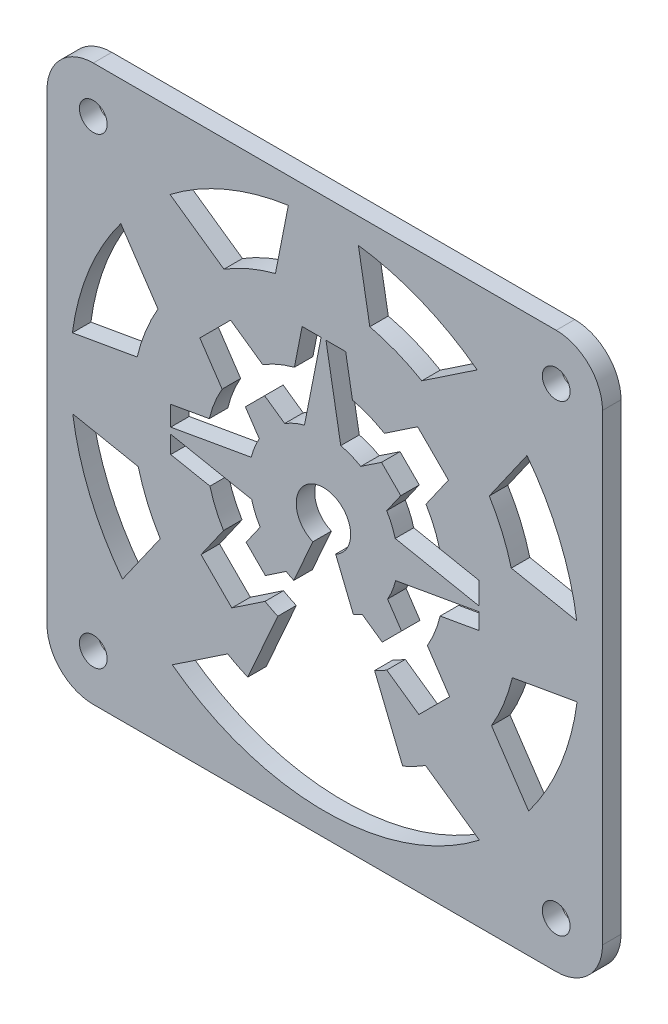
from build123d import *

# Parameters (mm, degrees)
SCHIZZO1_R                   = 1.5
ESTRUSIONE_ESTRUSIONE1_DEPTH = 2
TAGLIO_ESTRUSIONE1_DEPTH     = 2
ESTRUSIONE_ESTRUSIONE2_DEPTH = 2


with BuildPart() as part:
    # Schizzo1 → Estrusione-Estrusione1 (new body)
    with BuildSketch(Plane.XY):
        with BuildLine():
            Line((4.009057919, 37.078949925), (4.009057919, -12.921050075))
            ThreePointArc((4.009057919, -12.921050075), (2.544591824, -16.456583981), (-0.990942081, -17.921050075))
            Line((-0.990942081, -17.921050075), (-50.990942081, -17.921050075))
            ThreePointArc((-50.990942081, -17.921050075), (-54.526475987, -16.456583981), (-55.990942081, -12.921050075))
            Line((-55.990942081, -12.921050075), (-55.990942081, 37.078949925))
            ThreePointArc((-55.990942081, 37.078949925), (-54.526475987, 40.614483831), (-50.990942081, 42.078949925))
            Line((-50.990942081, 42.078949925), (-0.990942081, 42.078949925))
            ThreePointArc((-0.990942081, 42.078949925), (2.544591824, 40.614483831), (4.009057919, 37.078949925))
        make_face()
        with Locations((-50.990942081, 37.078949925)):
            Circle(SCHIZZO1_R, mode=Mode.SUBTRACT)
        with Locations((-0.990942081, 37.078949925)):
            Circle(SCHIZZO1_R, mode=Mode.SUBTRACT)
        with Locations((-50.990942081, -12.921050075)):
            Circle(SCHIZZO1_R, mode=Mode.SUBTRACT)
        with Locations((-0.990942081, -12.921050075)):
            Circle(SCHIZZO1_R, mode=Mode.SUBTRACT)
        with BuildLine():
            Line((-31.315733716, 32.226325066), (-29.922818488, 39.296413949))
            ThreePointArc((-29.922818488, 39.296413949), (-36.65420027, 37.427419796), (-42.697428035, 33.922560594))
            Line((-42.697428035, 33.922560594), (-36.878383255, 29.847848476))
            ThreePointArc((-36.878383255, 29.847848476), (-34.183829904, 31.240022968), (-31.315733716, 32.226325066))
        make_face(mode=Mode.SUBTRACT)
        with BuildLine():
            Line((-22.358446359, 39.337984663), (-21.125016906, 32.342042069))
            ThreePointArc((-21.125016906, 32.342042069), (-18.235263935, 31.421121146), (-15.509792769, 30.090491783))
            Line((-15.509792769, 30.090491783), (-9.525545173, 34.104859773))
            ThreePointArc((-9.525545173, 34.104859773), (-15.606929318, 37.543087038), (-22.358446359, 39.337984663))
        make_face(mode=Mode.SUBTRACT)
        with BuildLine():
            Line((-4.147331412, 28.785435879), (-8.22204353, 22.966391099))
            ThreePointArc((-8.22204353, 22.966391099), (-6.829869038, 20.271837748), (-5.84356694, 17.403741559))
            Line((-5.84356694, 17.403741559), (1.226521943, 16.010826332))
            ThreePointArc((1.226521943, 16.010826332), (-0.642472211, 22.742208114), (-4.147331412, 28.785435879))
        make_face(mode=Mode.SUBTRACT)
        with BuildLine():
            Line((1.268092656, 8.446454203), (-5.727849938, 7.213024749))
            ThreePointArc((-5.727849938, 7.213024749), (-6.648770861, 4.323271778), (-7.979400223, 1.597800612))
            Line((-7.979400223, 1.597800612), (-3.965032233, -4.386446983))
            ThreePointArc((-3.965032233, -4.386446983), (-0.526804968, 1.694937161), (1.268092656, 8.446454203))
        make_face(mode=Mode.SUBTRACT)
        with BuildLine():
            Line((-9.284456128, -9.764660744), (-15.103500908, -5.689948626))
            ThreePointArc((-15.103500908, -5.689948626), (-16.317583854, -6.379009649), (-17.575076336, -6.985239929))
            Line((-17.575076336, -6.985239929), (-22.566296054, 5.239602614))
            ThreePointArc((-22.566296054, 5.239602614), (-26.23827157, 19.723797875), (-28.966350145, 5.032545245))
            Line((-28.966350145, 5.032545245), (-34.305917557, -7.029459582))
            ThreePointArc((-34.305917557, -7.029459582), (-35.404993092, -6.512601237), (-36.472091394, -5.932591934))
            Line((-36.472091394, -5.932591934), (-42.45633899, -9.946959923))
            ThreePointArc((-42.45633899, -9.946959923), (-25.839815546, -15.420634813), (-9.284456128, -9.764660744))
        make_face(mode=Mode.SUBTRACT)
        with BuildLine():
            Line((-47.834552751, -4.627536029), (-43.759840633, 1.191508751))
            ThreePointArc((-43.759840633, 1.191508751), (-45.152015125, 3.886062102), (-46.138317223, 6.754158291))
            Line((-46.138317223, 6.754158291), (-53.208406106, 8.147073518))
            ThreePointArc((-53.208406106, 8.147073518), (-51.339411952, 1.415691736), (-47.834552751, -4.627536029))
        make_face(mode=Mode.SUBTRACT)
        with BuildLine():
            Line((-53.249976819, 15.711445647), (-46.254034225, 16.944875101))
            ThreePointArc((-46.254034225, 16.944875101), (-45.333113302, 19.834628071), (-44.00248394, 22.560099238))
            Line((-44.00248394, 22.560099238), (-48.01685193, 28.544346833))
            ThreePointArc((-48.01685193, 28.544346833), (-51.455079195, 22.462962688), (-53.249976819, 15.711445647))
        make_face(mode=Mode.SUBTRACT)
    extrude(amount=ESTRUSIONE_ESTRUSIONE1_DEPTH)

    # Schizzo2 → Taglio-Estrusione1 (cut)
    with BuildSketch(Plane.XY):
        with BuildLine():
            Line((-29.267736933, 24.477334627), (-28.432897549, 28.714770282))
            Line((-28.432897549, 28.714770282), (-23.731058754, 28.714770282))
            Line((-23.731058754, 28.714770282), (-22.996526589, 24.54854509))
            ThreePointArc((-22.996526589, 24.54854509), (-21.218217068, 23.981824522), (-19.541004043, 23.162975684))
            Line((-19.541004043, 23.162975684), (-15.954363967, 25.56897458))
            Line((-15.954363967, 25.56897458), (-12.629661871, 22.244272484))
            Line((-12.629661871, 22.244272484), (-15.056235281, 18.778913724))
            ThreePointArc((-15.056235281, 18.778913724), (-14.199512517, 17.120727047), (-13.592557379, 15.355744777))
            Line((-13.592557379, 15.355744777), (-9.355121725, 14.520905393))
            Line((-9.355121725, 14.520905393), (-9.355121725, 9.819066597))
            Line((-9.355121725, 9.819066597), (-13.521346916, 9.084534432))
            ThreePointArc((-13.521346916, 9.084534432), (-14.088067484, 7.306224912), (-14.906916322, 5.629011886))
            Line((-14.906916322, 5.629011886), (-12.500917426, 2.042371811))
            Line((-12.500917426, 2.042371811), (-15.825619522, -1.282330286))
            Line((-15.825619522, -1.282330286), (-19.290978282, 1.144243124))
            ThreePointArc((-19.290978282, 1.144243124), (-20.038106249, 0.720205572), (-20.811947777, 0.347140784))
            Line((-20.811947777, 0.347140784), (-23.883467603, 7.870120811))
            ThreePointArc((-23.883467603, 7.870120811), (-26.524135322, 16.755636376), (-27.096941459, 7.503749758))
            Line((-27.096941459, 7.503749758), (-30.402118498, 0.037403083))
            ThreePointArc((-30.402118498, 0.037403083), (-31.442562341, 0.471316046), (-32.44088012, 0.994924166))
            Line((-32.44088012, 0.994924166), (-36.027520196, -1.411074731))
            Line((-36.027520196, -1.411074731), (-39.352222292, 1.913627366))
            Line((-39.352222292, 1.913627366), (-36.925648882, 5.378986126))
            ThreePointArc((-36.925648882, 5.378986126), (-37.782371646, 7.037172803), (-38.389326784, 8.802155073))
            Line((-38.389326784, 8.802155073), (-42.626762438, 9.636994457))
            Line((-42.626762438, 9.636994457), (-42.626762438, 14.338833252))
            Line((-42.626762438, 14.338833252), (-38.460537247, 15.073365418))
            ThreePointArc((-38.460537247, 15.073365418), (-37.893816679, 16.851674938), (-37.074967841, 18.528887964))
            Line((-37.074967841, 18.528887964), (-39.480966737, 22.115528039))
            Line((-39.480966737, 22.115528039), (-36.156264641, 25.440230135))
            Line((-36.156264641, 25.440230135), (-32.690905881, 23.013656726))
            ThreePointArc((-32.690905881, 23.013656726), (-31.032719203, 23.87037949), (-29.267736933, 24.477334627))
        make_face()
    extrude(amount=TAGLIO_ESTRUSIONE1_DEPTH, mode=Mode.SUBTRACT)

    # Schizzo3 → Estrusione-Estrusione2 (add)
    with BuildSketch(Plane.XY):
        with BuildLine():
            Line((-28.179815713, 19.609421722), (-26.38592332, 28.714770282))
            Line((-26.38592332, 28.714770282), (-25.857793685, 28.714770282))
            Line((-25.857793685, 28.714770282), (-24.260309247, 19.653928262))
            ThreePointArc((-24.260309247, 19.653928262), (-23.148865797, 19.299727906), (-22.100607656, 18.787947383))
            Line((-22.100607656, 18.787947383), (-19.858957609, 20.291696693))
            Line((-19.858957609, 20.291696693), (-17.781018799, 18.213757883))
            Line((-17.781018799, 18.213757883), (-19.29762718, 16.047908658))
            ThreePointArc((-19.29762718, 16.047908658), (-18.762175452, 15.011541984), (-18.382828491, 13.908428066))
            Line((-18.382828491, 13.908428066), (-9.355121725, 12.129832289))
            Line((-9.355121725, 12.129832289), (-9.355121725, 11.572717293))
            Line((-9.355121725, 11.572717293), (-18.338321952, 9.9889216))
            ThreePointArc((-18.338321952, 9.9889216), (-18.692522307, 8.87747815), (-19.204302831, 7.829220009))
            Line((-19.204302831, 7.829220009), (-17.70055352, 5.587569962))
            Line((-17.70055352, 5.587569962), (-19.778492331, 3.509631152))
            Line((-19.778492331, 3.509631152), (-21.944341556, 5.026239533))
            ThreePointArc((-21.944341556, 5.026239533), (-22.411296535, 4.761216062), (-22.89494749, 4.52805057))
            Line((-22.89494749, 4.52805057), (-24.814647381, 9.229913087))
            ThreePointArc((-24.814647381, 9.229913087), (-26.226945656, 14.800757418), (-27.276206647, 9.150275637))
            Line((-27.276206647, 9.150275637), (-29.329886421, 4.511043011))
            ThreePointArc((-29.329886421, 4.511043011), (-29.75260778, 4.709834682), (-30.163030204, 4.932915184))
            Line((-30.163030204, 4.932915184), (-32.404680252, 3.429165873))
            Line((-32.404680252, 3.429165873), (-34.482619062, 5.507104684))
            Line((-34.482619062, 5.507104684), (-32.966010681, 7.672953909))
            ThreePointArc((-32.966010681, 7.672953909), (-33.501462408, 8.709320582), (-33.880809369, 9.812434501))
            Line((-33.880809369, 9.812434501), (-42.626762438, 11.535520506))
            Line((-42.626762438, 11.535520506), (-42.626762438, 12.197820253))
            Line((-42.626762438, 12.197820253), (-33.925315908, 13.731940966))
            ThreePointArc((-33.925315908, 13.731940966), (-33.571115553, 14.843384416), (-33.05933503, 15.891642557))
            Line((-33.05933503, 15.891642557), (-34.56308434, 18.133292605))
            Line((-34.56308434, 18.133292605), (-32.48514553, 20.211231415))
            Line((-32.48514553, 20.211231415), (-30.319296305, 18.694623034))
            ThreePointArc((-30.319296305, 18.694623034), (-29.282929631, 19.230074761), (-28.179815713, 19.609421722))
        make_face()
    extrude(amount=ESTRUSIONE_ESTRUSIONE2_DEPTH)


solid = part.part
